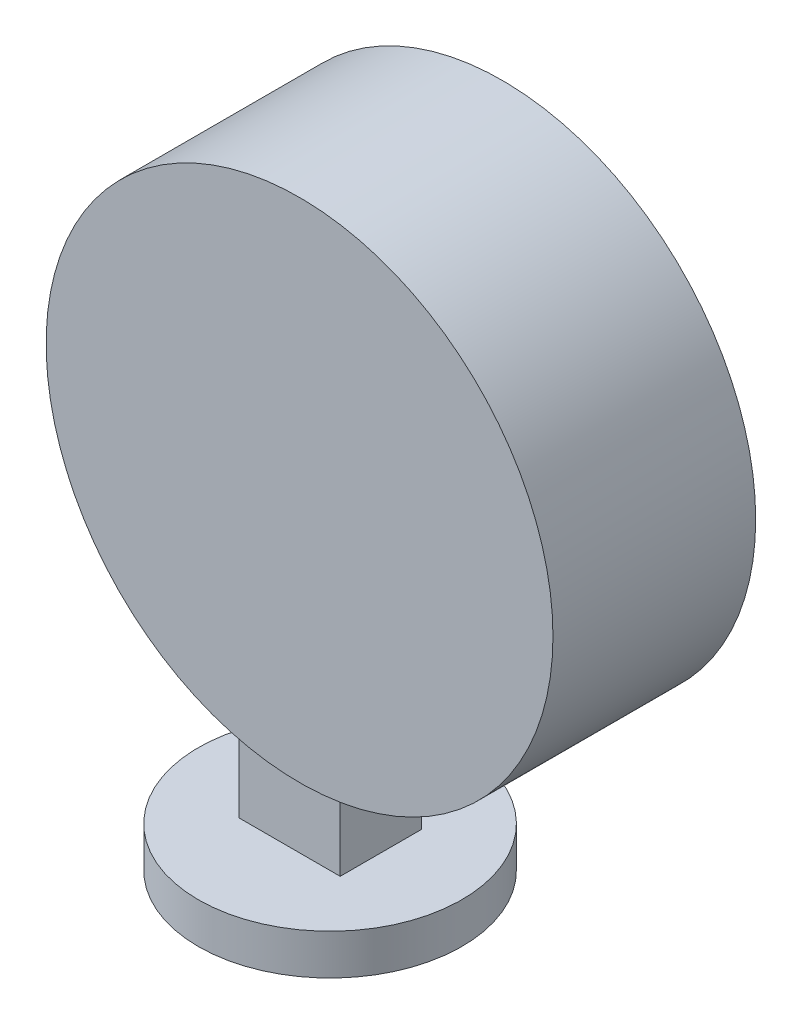
from build123d import *

# Parameters (mm, degrees)
SKETCH1_R                = 6.5
BOSS_EXTRUDE1_DEPTH      = 2
BOSS_EXTRUDE2_DEPTH      = 2
BOSS_EXTRUDE2_DEPTH_BACK = 2
BOSS_EXTRUDE3_DEPTH      = 5
BOSS_EXTRUDE3_DEPTH_BACK = 5
SKETCH3_R                = 12.5


with BuildPart() as part:
    # Sketch1 → Boss-Extrude1 (new body)
    with BuildSketch(Plane(origin=(0, 0, 0), x_dir=(1, 0, 0), z_dir=(0, 1, 0))):
        Circle(SKETCH1_R)
    extrude(amount=BOSS_EXTRUDE1_DEPTH)

    # Sketch2 → Boss-Extrude2 (add, two sides: drawn at the far end of the back side and taken through both)
    with BuildSketch(Plane.XY.offset(-BOSS_EXTRUDE2_DEPTH_BACK)):
        with BuildLine():
            Line((-2.5, 2), (-2.5, 17.005808669))
            ThreePointArc((-2.5, 17.005808669), (-0.744342007, 21.244342007), (3.494191331, 23))
            ThreePointArc((3.494191331, 23), (5.994191331, 20.5), (3.494191331, 18))
            ThreePointArc((3.494191331, 18), (2.791191899, 17.708808101), (2.5, 17.005808669))
            Line((2.5, 17.005808669), (2.5, 2))
            Line((2.5, 2), (-2.5, 2))
        make_face()
    extrude(amount=BOSS_EXTRUDE2_DEPTH + BOSS_EXTRUDE2_DEPTH_BACK)

    # Sketch3 → Boss-Extrude3 (add, two sides: drawn at the far end of the back side and taken through both)
    with BuildSketch(Plane.XY.offset(-BOSS_EXTRUDE3_DEPTH_BACK)):
        with Locations((3.494191331, 20.5)):
            Circle(SKETCH3_R)
    extrude(amount=BOSS_EXTRUDE3_DEPTH + BOSS_EXTRUDE3_DEPTH_BACK)


solid = part.part
